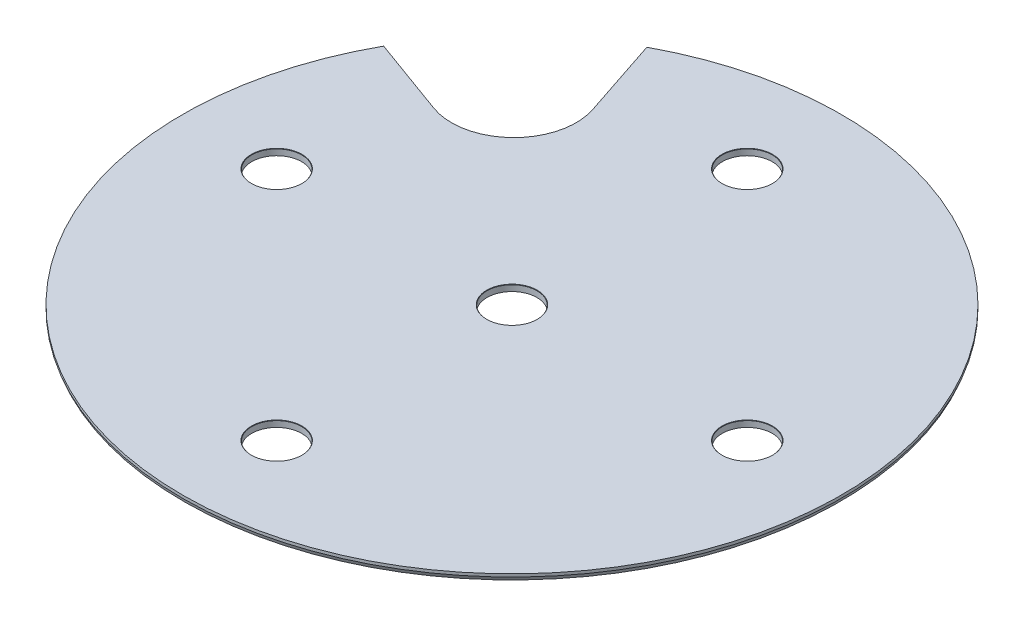
from build123d import *

# Parameters (mm, degrees)
SKETCH1_R                         = 26.4
BOSS_EXTRUDE1_DEPTH               = 0.5
F_4_0_4_DIAMETER_HOLE1_AT_2_COUNT = 2
F_4_0_4_DIAMETER_HOLE1_AT_2_PITCH = 18.85
F_4_0_4_DIAMETER_HOLE1_AT_3_COUNT = 2
F_4_0_4_DIAMETER_HOLE1_AT_3_PITCH = 18.85
F_4_0_4_DIAMETER_HOLE1_AT_4_COUNT = 2
F_4_0_4_DIAMETER_HOLE1_AT_4_PITCH = 18.85
F_4_0_4_DIAMETER_HOLE1_AT_5_COUNT = 2
F_4_0_4_DIAMETER_HOLE1_AT_5_PITCH = 18.85
CHAMFER1_SIZE                     = 0.1
CHAMFER1_SIZE2                    = 0.274747742
SKETCH5_R                         = 5
CUT_EXTRUDE1_DEPTH                = 38.33858594


with BuildPart() as part:
    # Sketch1 → Boss-Extrude1 (new body)
    with BuildSketch(Plane(origin=(0, 0, 0), x_dir=(1, 0, 0), z_dir=(0, 1, 0))):
        with Locations(Location((0, 0, 0), (0, 0, 270))):
            Circle(SKETCH1_R)
    extrude(amount=BOSS_EXTRUDE1_DEPTH)

    # Sketch4 → Ø4.0 (4) Diameter Hole1 (revolve, cut)
    with BuildSketch(Plane(origin=(0, 0.5, 0), x_dir=(0, 0, 1), z_dir=(1, 0, 0))):
        Polygon((0, 0), (0, 0.5), (2, 0.5), (2, 0.027282713), (2.025, 0), align=None)
    f_4_0_4_diameter_hole1 = revolve(axis=Axis((0, 6.85, 0), (0, -1, 0)), mode=Mode.SUBTRACT)

    # Ø4.0 (4) Diameter Hole1 at 2: Ø4.0 (4) Diameter Hole1 ×2
    with Locations(*[(-i * F_4_0_4_DIAMETER_HOLE1_AT_2_PITCH, 0, 0) for i in range(1, F_4_0_4_DIAMETER_HOLE1_AT_2_COUNT)]):
        add(f_4_0_4_diameter_hole1, mode=Mode.SUBTRACT)

    # Ø4.0 (4) Diameter Hole1 at 3: Ø4.0 (4) Diameter Hole1 ×2
    with Locations(*[(0, 0, -i * F_4_0_4_DIAMETER_HOLE1_AT_3_PITCH) for i in range(1, F_4_0_4_DIAMETER_HOLE1_AT_3_COUNT)]):
        add(f_4_0_4_diameter_hole1, mode=Mode.SUBTRACT)

    # Ø4.0 (4) Diameter Hole1 at 4: Ø4.0 (4) Diameter Hole1 ×2
    with Locations(*[(i * F_4_0_4_DIAMETER_HOLE1_AT_4_PITCH, 0, 0) for i in range(1, F_4_0_4_DIAMETER_HOLE1_AT_4_COUNT)]):
        add(f_4_0_4_diameter_hole1, mode=Mode.SUBTRACT)

    # Ø4.0 (4) Diameter Hole1 at 5: Ø4.0 (4) Diameter Hole1 ×2
    with Locations(*[(0, 0, i * F_4_0_4_DIAMETER_HOLE1_AT_5_PITCH) for i in range(1, F_4_0_4_DIAMETER_HOLE1_AT_5_COUNT)]):
        add(f_4_0_4_diameter_hole1, mode=Mode.SUBTRACT)

    # Chamfer1
    chamfer1_edges = [part.edges().sort_by_distance(p)[0] for p in [
        (0, 0, -26.4),
    ]]
    chamfer1_side = [part.faces().sort_by_distance(p)[0] for p in [
        (0, 0, -25.653295239),
    ]]
    chamfer(chamfer1_edges, length=CHAMFER1_SIZE, length2=CHAMFER1_SIZE2, reference=chamfer1_side[0])

    # Sketch5 → Cut-Extrude1 (cut, through all)
    with BuildSketch(Plane(origin=(0, 0.5, 0), x_dir=(1, 0, 0), z_dir=(0, 1, 0))):
        with Locations((-15.056400691, 15.207392881)):
            Circle(SKETCH5_R)
        with BuildLine():
            ThreePointArc((-18.57425135, 18.760522029), (-21.042056901, 15.943394914), (-23.086392584, 12.805408134))
            Line((-23.086392584, 12.805408134), (-16.76402379, 10.508028737))
            ThreePointArc((-16.76402379, 10.508028737), (-19.940282895, 14.136087779), (-18.57425135, 18.760522029))
        make_face()
        with BuildLine():
            ThreePointArc((-12.466103662, 23.271361359), (-15.683202086, 21.236694007), (-18.57425135, 18.760522029))
            ThreePointArc((-18.57425135, 18.760522029), (-13.892859594, 20.070125869), (-10.311269735, 16.783378987))
            Line((-10.311269735, 16.783378987), (-12.466103662, 23.271361359))
        make_face()
    extrude(amount=-CUT_EXTRUDE1_DEPTH, mode=Mode.SUBTRACT)


solid = part.part
